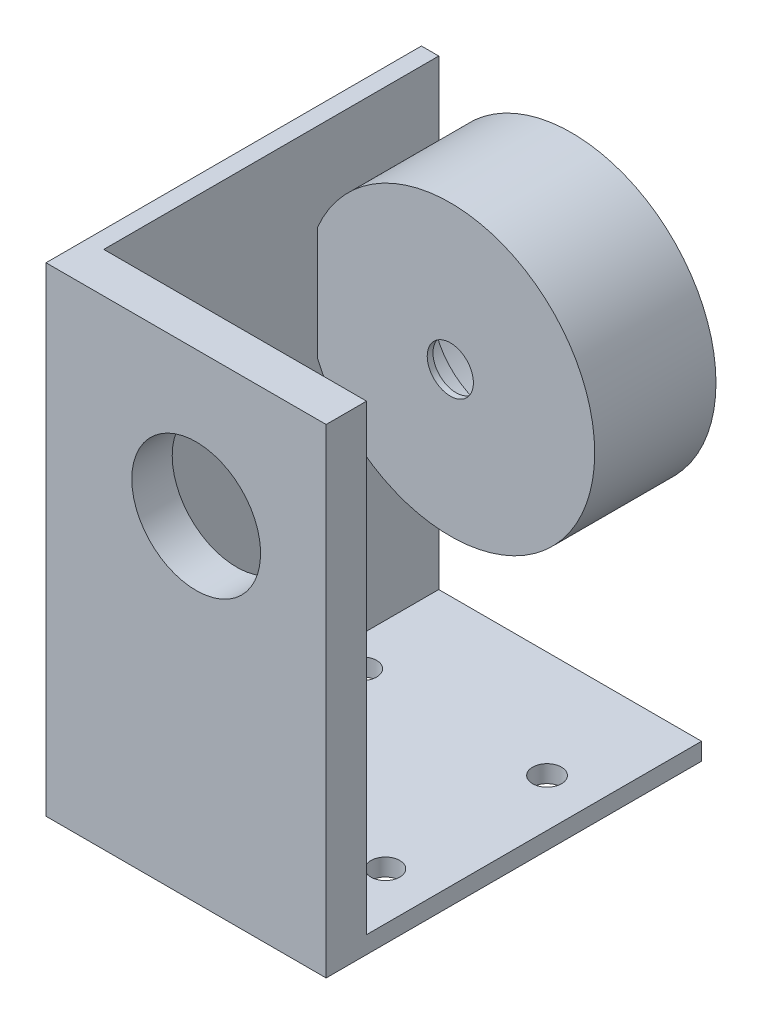
from build123d import *

# Parameters (mm, degrees)
SKETCH2_W           = 48.5
SKETCH2_H           = 65
SKETCH2_R           = 2.5
BOSS_EXTRUDE1_DEPTH = 3
BOSS_EXTRUDE2_DEPTH = 80
SKETCH6_R           = 22.5
BOSS_EXTRUDE3_DEPTH = 13
BOSS_EXTRUDE4_DEPTH = 8
SKETCH12_R          = 11.1
CUT_EXTRUDE1_DEPTH  = 7
SKETCH13_R          = 4
CUT_EXTRUDE2_DEPTH  = 78
SKETCH14_R          = 11.15
CUT_EXTRUDE3_DEPTH  = 10


with BuildPart() as part:
    # Sketch2 → Boss-Extrude1 (new body)
    with BuildSketch(Plane(origin=(0, 0, 0), x_dir=(1, 0, 0), z_dir=(0, 1, 0))):
        Rectangle(SKETCH2_W, SKETCH2_H)
        with Locations(Location((-16, 14, 0), (0, 0, 270))):
            Circle(SKETCH2_R, mode=Mode.SUBTRACT)
        with Locations(Location((16, 14, 0), (0, 0, 90))):
            Circle(SKETCH2_R, mode=Mode.SUBTRACT)
        with Locations(Location((16, -14, 0), (0, 0, 270))):
            Circle(SKETCH2_R, mode=Mode.SUBTRACT)
        with Locations(Location((-16, -14, 0), (0, 0, 90))):
            Circle(SKETCH2_R, mode=Mode.SUBTRACT)
    extrude(amount=BOSS_EXTRUDE1_DEPTH)

    # Sketch3 → Boss-Extrude2 (add)
    with BuildSketch(Plane(origin=(0, 3, 0), x_dir=(1, 0, 0), z_dir=(0, 1, 0))):
        Polygon((-24.25, 32.5), (-24.25, -32.5), (24.25, -32.5), (24.25, -25.5), (-21.25, -25.5), (-21.25, 32.5), align=None)
    extrude(amount=BOSS_EXTRUDE2_DEPTH)

    # Sketch6 → Boss-Extrude3 (add)
    with BuildSketch(Plane(origin=(0, 0, -32.5), x_dir=(-1, 0, 0), z_dir=(0, 0, -1))):
        with BuildLine():
            Line((21.25, 67.797958971), (21.25, 48.202041029))
            ThreePointArc((21.25, 48.202041029), (-26.75, 58), (21.25, 67.797958971))
        make_face()
        with Locations((-1.75, 58)):
            Circle(SKETCH6_R, mode=Mode.SUBTRACT)
    extrude(amount=-BOSS_EXTRUDE3_DEPTH)

    # Sketch10 → Boss-Extrude4 (add)
    with BuildSketch(Plane.XY.offset(-19.5)):
        with BuildLine():
            Line((-21.25, 67.797958971), (-21.25, 48.202041029))
            ThreePointArc((-21.25, 48.202041029), (26.75, 58), (-21.25, 67.797958971))
        make_face()
    extrude(amount=BOSS_EXTRUDE4_DEPTH)

    # Sketch12 → Cut-Extrude1 (cut)
    with BuildSketch(Plane(origin=(0, 0, -19.5), x_dir=(-1, 0, 0), z_dir=(0, 0, -1))):
        with Locations((-1.75, 58)):
            Circle(SKETCH12_R)
    extrude(amount=-CUT_EXTRUDE1_DEPTH, mode=Mode.SUBTRACT)

    # Sketch13 → Cut-Extrude2 (cut)
    with BuildSketch(Plane(origin=(0, 0, -12.5), x_dir=(-1, 0, 0), z_dir=(0, 0, -1))):
        with Locations((-1.75, 58)):
            Circle(SKETCH13_R)
    extrude(amount=-CUT_EXTRUDE2_DEPTH, mode=Mode.SUBTRACT)

    # Sketch14 → Cut-Extrude3 (cut)
    with BuildSketch(Plane(origin=(0, 0, 25.5), x_dir=(-1, 0, 0), z_dir=(0, 0, -1))):
        with Locations((-1.75, 58)):
            Circle(SKETCH14_R)
    extrude(amount=-CUT_EXTRUDE3_DEPTH, mode=Mode.SUBTRACT)


solid = part.part
